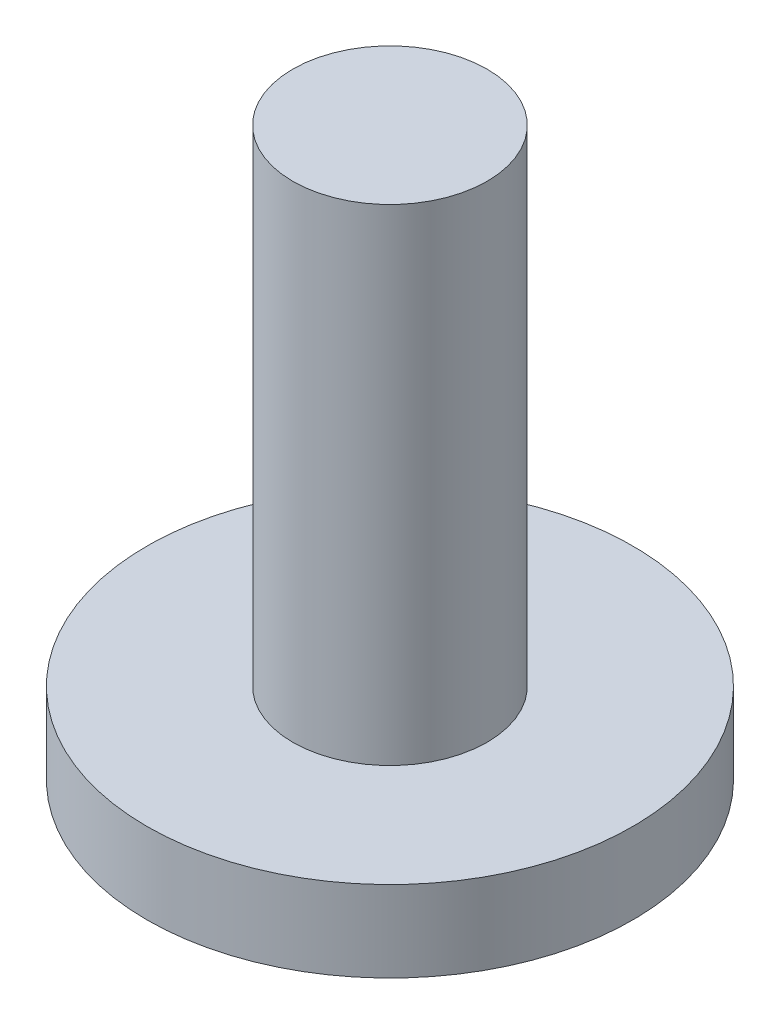
from build123d import *

# Parameters (mm, degrees)
SKETCH1_R           = 3
BOSS_EXTRUDE1_DEPTH = 1
SKETCH2_R           = 1.2
BOSS_EXTRUDE2_DEPTH = 6


with BuildPart() as part:
    # Sketch1 → Boss-Extrude1 (new body)
    with BuildSketch(Plane(origin=(0, 0, 0), x_dir=(1, 0, 0), z_dir=(0, 1, 0))):
        with Locations(Location((0, 0, 0), (0, 0, 270))):
            Circle(SKETCH1_R)
    extrude(amount=BOSS_EXTRUDE1_DEPTH)

    # Sketch2 → Boss-Extrude2 (add)
    with BuildSketch(Plane(origin=(0, 1, 0), x_dir=(1, 0, 0), z_dir=(0, 1, 0))):
        with Locations(Location((0, 0, 0), (0, 0, 270))):
            Circle(SKETCH2_R)
    extrude(amount=BOSS_EXTRUDE2_DEPTH)


solid = part.part
